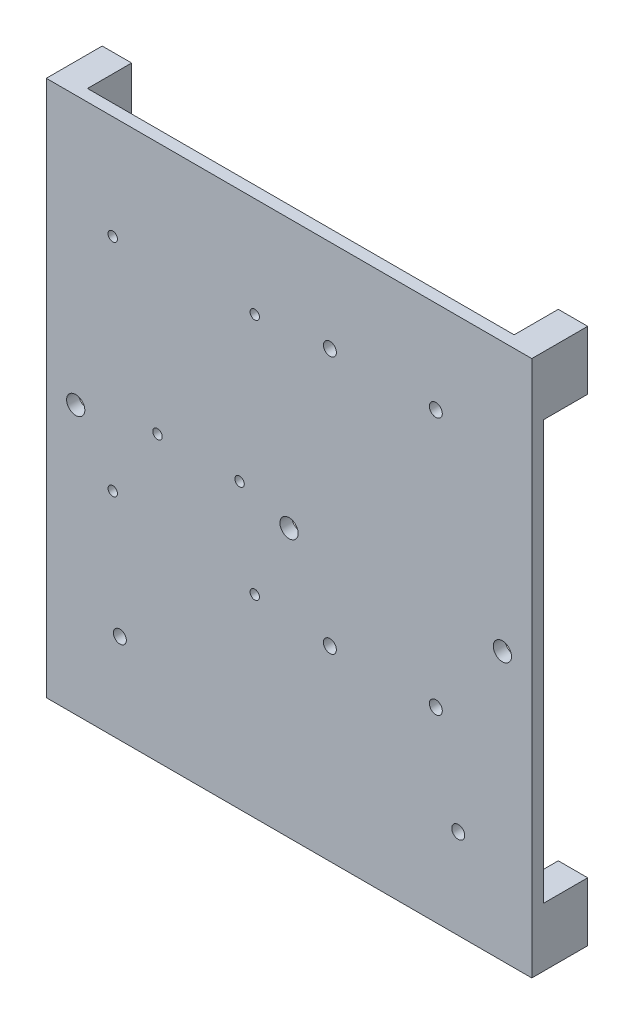
from build123d import *

# Parameters (mm, degrees)
SKETCH1_W           = 165
SKETCH1_H           = 182.31
BOSS_EXTRUDE1_DEPTH = 4
SKETCH2_R           = 2.2
SKETCH2_R_2         = 1.6
CUT_EXTRUDE1_DEPTH  = 4
SKETCH3_W           = 10
SKETCH3_H           = 20
BOSS_EXTRUDE2_DEPTH = 15
CUT_EXTRUDE2_REACH  = 175.429
SKETCH4_R           = 3.1


with BuildPart() as part:
    # Sketch1 → Boss-Extrude1 (new body)
    with BuildSketch(Plane.XY):
        with Locations((0, 60.655)):
            Rectangle(SKETCH1_W, SKETCH1_H)
    extrude(amount=BOSS_EXTRUDE1_DEPTH)

    # Sketch2 → Cut-Extrude1 (cut)
    with BuildSketch(Plane(origin=(0, 0, 0), x_dir=(-1, 0, 0), z_dir=(0, 0, -1))):
        with Locations((-49.884295567, 120.4)):
            Circle(SKETCH2_R)
        with Locations((-49.884295567, 32.9)):
            Circle(SKETCH2_R)
        with Locations((-13.884295567, 32.9)):
            Circle(SKETCH2_R)
        with Locations((-13.884295567, 120.4)):
            Circle(SKETCH2_R)
        with Locations((57.5, 0)):
            Circle(SKETCH2_R)
        with Locations((-57.5, 0)):
            Circle(SKETCH2_R)
        with Locations((11.655704433, 35.29)):
            Circle(SKETCH2_R_2)
        with Locations((16.815704433, 66)):
            Circle(SKETCH2_R_2)
        with Locations((11.655704433, 117.69)):
            Circle(SKETCH2_R_2)
        with Locations((59.915704433, 116.57)):
            Circle(SKETCH2_R_2)
        with Locations((44.715704433, 66)):
            Circle(SKETCH2_R_2)
        with Locations((59.915704433, 41.64)):
            Circle(SKETCH2_R_2)
    extrude(amount=-CUT_EXTRUDE1_DEPTH, mode=Mode.SUBTRACT)

    # Sketch3 → Boss-Extrude2 (add)
    with BuildSketch(Plane(origin=(0, 0, 0), x_dir=(-1, 0, 0), z_dir=(0, 0, -1))):
        with Locations((-77.5, -20.5)):
            Rectangle(SKETCH3_W, SKETCH3_H)
        with Locations((-77.5, 141.81)):
            Rectangle(SKETCH3_W, SKETCH3_H)
        with Locations((77.5, -20.5)):
            Rectangle(SKETCH3_W, SKETCH3_H)
        with Locations((77.5, 141.81)):
            Rectangle(SKETCH3_W, SKETCH3_H)
    extrude(amount=BOSS_EXTRUDE2_DEPTH)

    # Sketch4 → Cut-Extrude2 (cut, up to next)
    with BuildSketch(Plane(origin=(0, 0, 0), x_dir=(-1, 0, 0), z_dir=(0, 0, -1)), mode=Mode.PRIVATE) as cut_extrude2_sk1:
        with Locations((-72.5, 60.655)):
            Circle(SKETCH4_R)
    cut_extrude2_tool1 = extrude(cut_extrude2_sk1.sketch, amount=-CUT_EXTRUDE2_REACH, mode=Mode.PRIVATE) & part.part
    # Sketch4 → Cut-Extrude2 (cut, up to next)
    with BuildSketch(Plane(origin=(0, 0, 0), x_dir=(-1, 0, 0), z_dir=(0, 0, -1)), mode=Mode.PRIVATE) as cut_extrude2_sk2:
        with Locations((72.5, 60.655)):
            Circle(SKETCH4_R)
    cut_extrude2_tool2 = extrude(cut_extrude2_sk2.sketch, amount=-CUT_EXTRUDE2_REACH, mode=Mode.PRIVATE) & part.part
    # Sketch4 → Cut-Extrude2 (cut, up to next)
    with BuildSketch(Plane(origin=(0, 0, 0), x_dir=(-1, 0, 0), z_dir=(0, 0, -1)), mode=Mode.PRIVATE) as cut_extrude2_sk3:
        with Locations((0, 60.655)):
            Circle(SKETCH4_R)
    cut_extrude2_tool3 = extrude(cut_extrude2_sk3.sketch, amount=-CUT_EXTRUDE2_REACH, mode=Mode.PRIVATE) & part.part
    add(cut_extrude2_tool1.solids().sort_by_distance((72.5, 60.655, 0))[0], mode=Mode.SUBTRACT)
    add(cut_extrude2_tool2.solids().sort_by_distance((-72.5, 60.655, 0))[0], mode=Mode.SUBTRACT)
    add(cut_extrude2_tool3.solids().sort_by_distance((0, 60.655, 0))[0], mode=Mode.SUBTRACT)


solid = part.part
